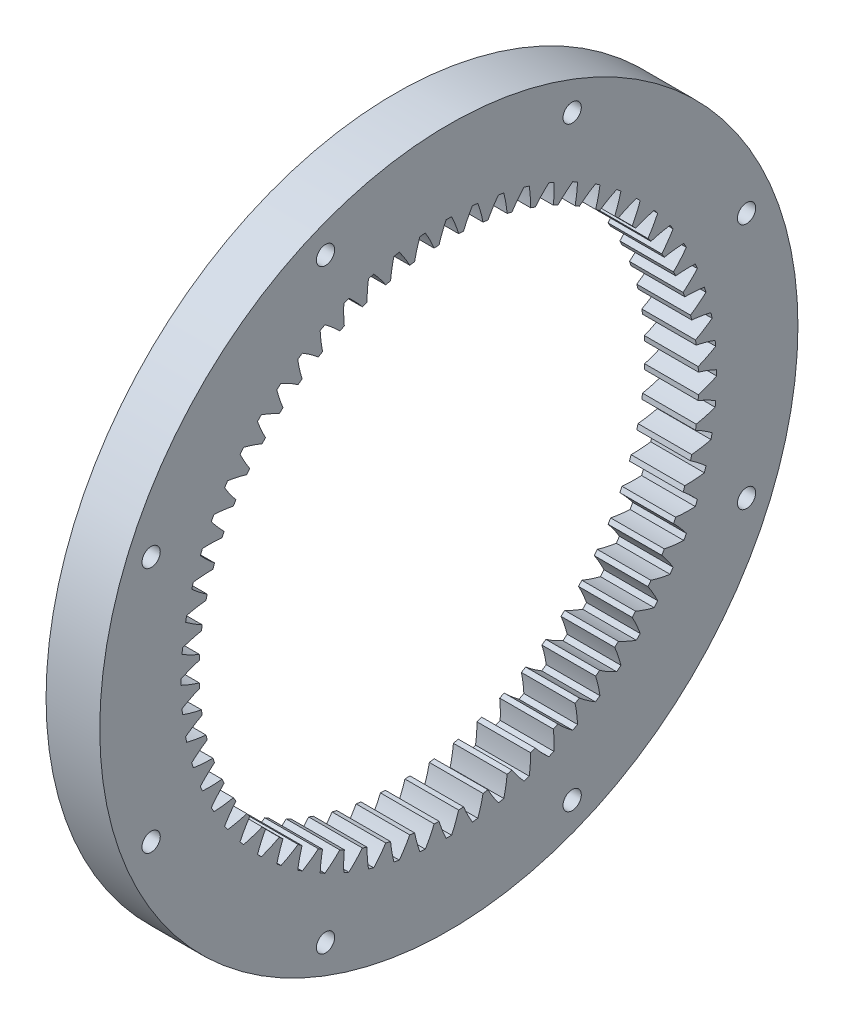
from build123d import *

# Parameters (mm, degrees)
BASPROSKE_W                      = 10
BASPROSKE_H                      = 8.5
TOOTHCUT_DEPTH                   = 79.421935707
TEETHCUTS_COUNT                  = 64
CROQUIS1_R                       = 65
CROQUIS1_R_2                     = 55
SALIENTE_EXTRUIR1_DEPTH          = 10
TALADRO_DE_MARGEN_PARA_M31_D     = 3.4
TALADRO_DE_MARGEN_PARA_M31_DEPTH = 10
TALADRO_DE_MARGEN_PARA_M31_TIP   = 1.021463052


with BuildPart() as part:
    # BasProSke → Base-Revolve (revolve)
    with BuildSketch(Plane(origin=(0, 0, 0), x_dir=(1, 0, 0), z_dir=(0, 1, 0)), mode=Mode.PRIVATE) as base_revolve_sk:
        with Locations((5, 50.75)):
            Rectangle(BASPROSKE_W, BASPROSKE_H)
    revolve(base_revolve_sk.sketch.rotate(Axis((-10, 0, 0), (1, 0, 0)), 180), axis=Axis((-10, 0, 0), (1, 0, 0)))

    # TooCutSke → ToothCut (cut, through all)
    with BuildSketch(Plane(origin=(0, 0, 0), x_dir=(0, 0, -1), z_dir=(1, 0, 0))):
        with BuildLine():
            ThreePointArc((1.826617407, 46.438689839), (1.235280536, 48.181244214), (0.512172869, 49.873370198))
            ThreePointArc((0.512172869, 49.873370198), (0, 49.876), (-0.512172869, 49.873370198))
            ThreePointArc((-0.512172869, 49.873370198), (-1.235280536, 48.181244214), (-1.826617407, 46.438689839))
            ThreePointArc((-1.826617407, 46.438689839), (0, 46.4746), (1.826617407, 46.438689839))
        make_face()
    toothcut = extrude(amount=TOOTHCUT_DEPTH, mode=Mode.SUBTRACT)

    # TeethCuts: ToothCut ×64 about axis
    teethcuts_axis = Axis((0, 0, 0), (1, 0, 0))
    for i in range(1, TEETHCUTS_COUNT):
        add(toothcut.rotate(teethcuts_axis, i * 360 / TEETHCUTS_COUNT), mode=Mode.SUBTRACT)

    # Croquis1 → Saliente-Extruir1 (add)
    with BuildSketch(Plane(origin=(10, 0, 0), x_dir=(0, 0, -1), z_dir=(1, 0, 0))):
        Circle(CROQUIS1_R)
        Circle(CROQUIS1_R_2, mode=Mode.SUBTRACT)
    extrude(amount=-SALIENTE_EXTRUIR1_DEPTH)

    # Taladro de margen para M31
    with Locations(Plane(origin=(10, 0, 0), x_dir=(0, 0, -1), z_dir=(1, 0, 0))):
        with Locations((22.961005942, 55.432771951), (55.432771951, 22.961005942), (55.432771951, -22.961005942), (22.961005942, -55.432771951), (-22.961005942, -55.432771951), (-55.432771951, -22.961005942), (-55.432771951, 22.961005942), (-22.961005942, 55.432771951)):
            Hole(TALADRO_DE_MARGEN_PARA_M31_D / 2, depth=TALADRO_DE_MARGEN_PARA_M31_DEPTH)
            with Locations((0, 0, -(TALADRO_DE_MARGEN_PARA_M31_DEPTH + TALADRO_DE_MARGEN_PARA_M31_TIP / 2))):  # 118° drill point
                Cone(0, TALADRO_DE_MARGEN_PARA_M31_D / 2, TALADRO_DE_MARGEN_PARA_M31_TIP, mode=Mode.SUBTRACT)


solid = part.part
